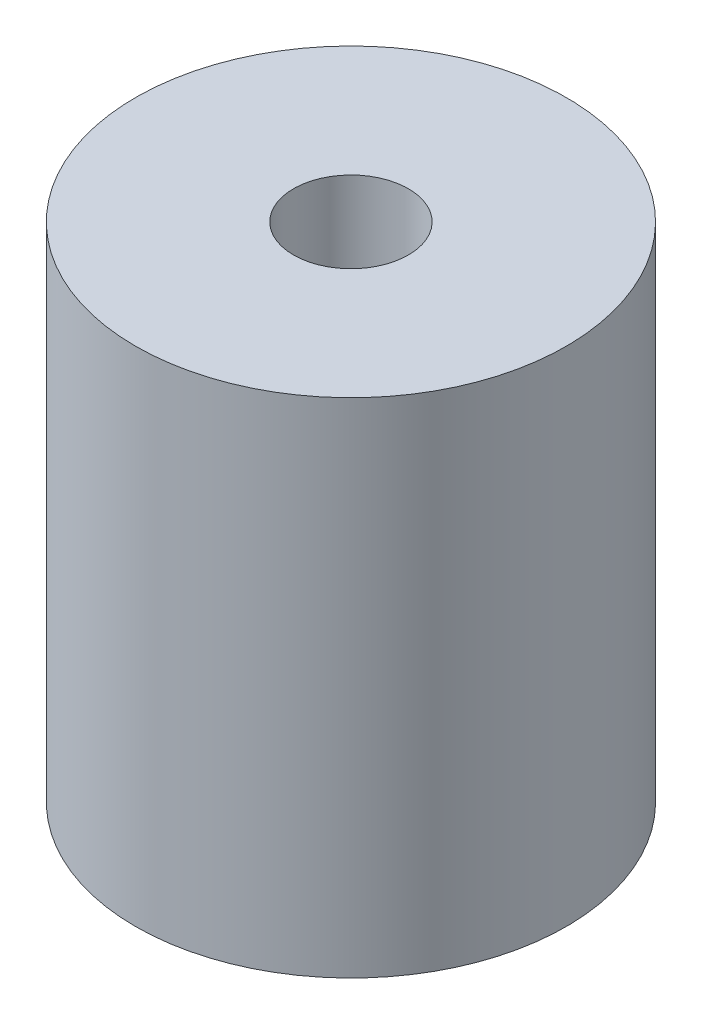
from build123d import *

# Parameters (mm, degrees)
SKETCH1_R           = 15
SKETCH1_R_2         = 6.35
BOSS_EXTRUDE1_DEPTH = 11
SKETCH2_R           = 15
BOSS_EXTRUDE2_DEPTH = 13
SKETCH3_R           = 15
SKETCH3_R_2         = 4
BOSS_EXTRUDE3_DEPTH = 11


with BuildPart() as part:
    # Sketch1 → Boss-Extrude1 (new body)
    with BuildSketch(Plane(origin=(0, 0, 0), x_dir=(1, 0, 0), z_dir=(0, 1, 0))):
        with Locations(Location((0, 0, 0), (0, 0, 270))):
            Circle(SKETCH1_R)
        with Locations(Location((0, 0, 0), (0, 0, 270))):
            Circle(SKETCH1_R_2, mode=Mode.SUBTRACT)
    extrude(amount=BOSS_EXTRUDE1_DEPTH)

    # Sketch2 → Boss-Extrude2 (add)
    with BuildSketch(Plane(origin=(0, 11, 0), x_dir=(1, 0, 0), z_dir=(0, 1, 0))):
        with Locations(Location((0, 0, 0), (0, 0, 270))):
            Circle(SKETCH2_R)
    extrude(amount=BOSS_EXTRUDE2_DEPTH)

    # Sketch3 → Boss-Extrude3 (add)
    with BuildSketch(Plane(origin=(0, 24, 0), x_dir=(1, 0, 0), z_dir=(0, 1, 0))):
        with Locations(Location((0, 0, 0), (0, 0, 270))):
            Circle(SKETCH3_R)
        with Locations(Location((0, 0, 0), (0, 0, 270))):
            Circle(SKETCH3_R_2, mode=Mode.SUBTRACT)
    extrude(amount=BOSS_EXTRUDE3_DEPTH)


solid = part.part
